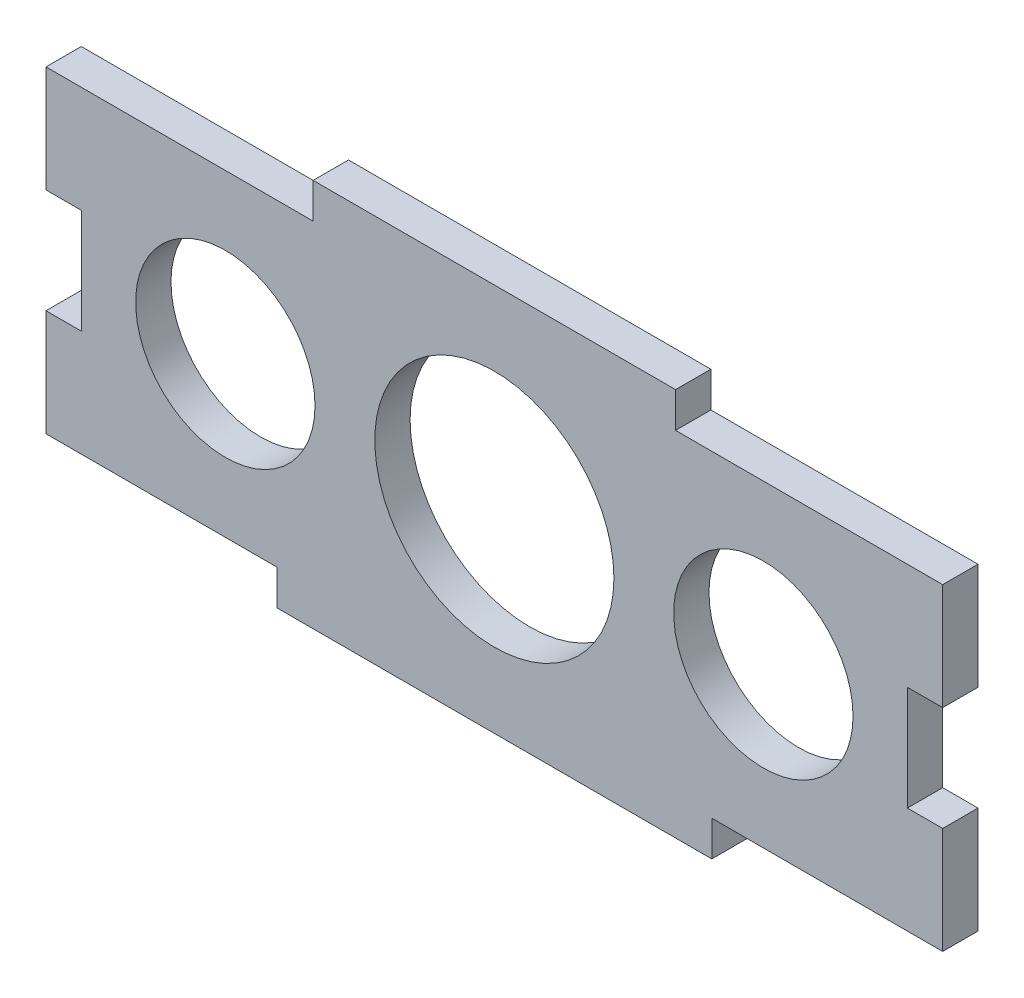
from build123d import *

# Parameters (mm, degrees)
SKETCH_1_W          = 76.2
SKETCH_1_H          = 30
EXTRUDE_1_DEPTH     = 3
SKETCH_2_W          = 19.6215
SKETCH_2_H          = 3
CUT_EXTRUDE_1_DEPTH = 3
SKETCH_3_W          = 3
SKETCH_3_H          = 8.89
CUT_EXTRUDE_2_DEPTH = 3
SKETCH_4_W          = 30.7975
SKETCH_4_H          = 3
EXTRUDE_2_DEPTH     = 3
SKETCH_6_R          = 10.16
SKETCH_6_R_2        = 7.62
CUT_EXTRUDE_4_DEPTH = 3


with BuildPart() as part:
    # 스케치1 → 보스-돌출1 (new body)
    with BuildSketch(Plane.XY):
        Rectangle(SKETCH_1_W, SKETCH_1_H)
    extrude(amount=EXTRUDE_1_DEPTH)

    # 스케치2 → 컷-돌출1 (cut)
    with BuildSketch(Plane.XY.offset(3)):
        with Locations((-28.28925, -13.5)):
            Rectangle(SKETCH_2_W, SKETCH_2_H)
        with Locations((28.28925, -13.5)):
            Rectangle(SKETCH_2_W, SKETCH_2_H)
    extrude(amount=-CUT_EXTRUDE_1_DEPTH, mode=Mode.SUBTRACT)

    # 스케치3 → 컷-돌출2 (cut)
    with BuildSketch(Plane.XY.offset(3)):
        with Locations((-36.6, 1.5)):
            Rectangle(SKETCH_3_W, SKETCH_3_H)
        with Locations((36.6, 1.5)):
            Rectangle(SKETCH_3_W, SKETCH_3_H)
    extrude(amount=-CUT_EXTRUDE_2_DEPTH, mode=Mode.SUBTRACT)

    # 스케치4 → 보스-돌출2 (add)
    with BuildSketch(Plane.XY.offset(3)):
        with Locations((0, 16.5)):
            Rectangle(SKETCH_4_W, SKETCH_4_H)
    extrude(amount=-EXTRUDE_2_DEPTH)

    # 스케치6 → 컷-돌출4 (cut)
    with BuildSketch(Plane.XY.offset(3)):
        with Locations((0, 1.5)):
            Circle(SKETCH_6_R)
        with Locations((-22.86, 1.5)):
            Circle(SKETCH_6_R_2)
        with Locations((22.86, 1.5)):
            Circle(SKETCH_6_R_2)
    extrude(amount=-CUT_EXTRUDE_4_DEPTH, mode=Mode.SUBTRACT)


solid = part.part
